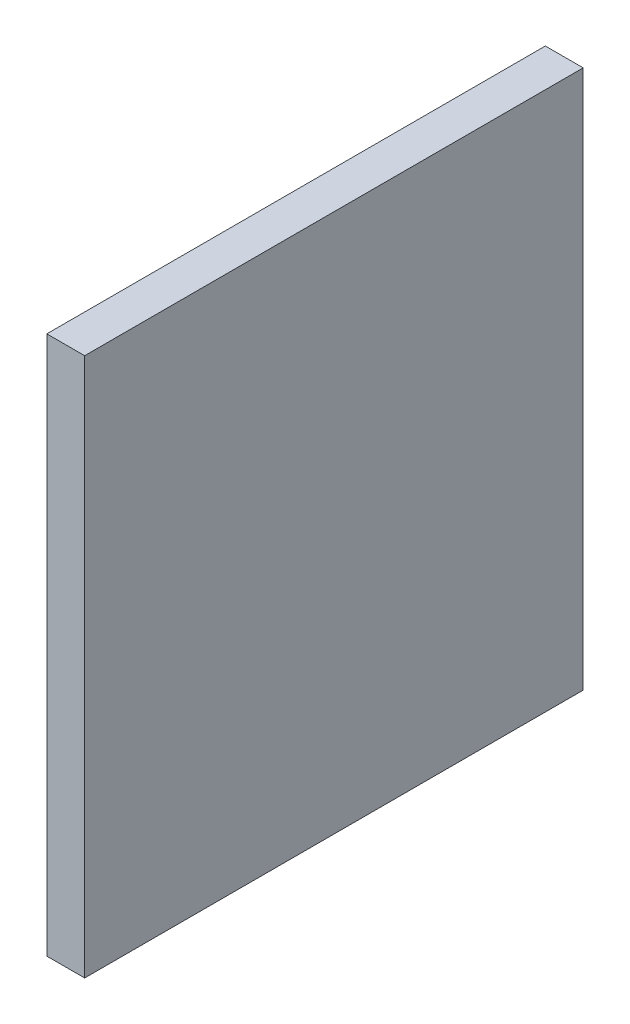
from build123d import *

# Parameters (mm, degrees)
SKETCH1_W           = 79
SKETCH1_H           = 85.4
BOSS_EXTRUDE1_DEPTH = 6


with BuildPart() as part:
    # Sketch1 → Boss-Extrude1 (new body)
    with BuildSketch(Plane(origin=(0, 0, 0), x_dir=(0, 0, -1), z_dir=(1, 0, 0))):
        with Locations((39.5, 42.7)):
            Rectangle(SKETCH1_W, SKETCH1_H)
    extrude(amount=BOSS_EXTRUDE1_DEPTH)


solid = part.part
